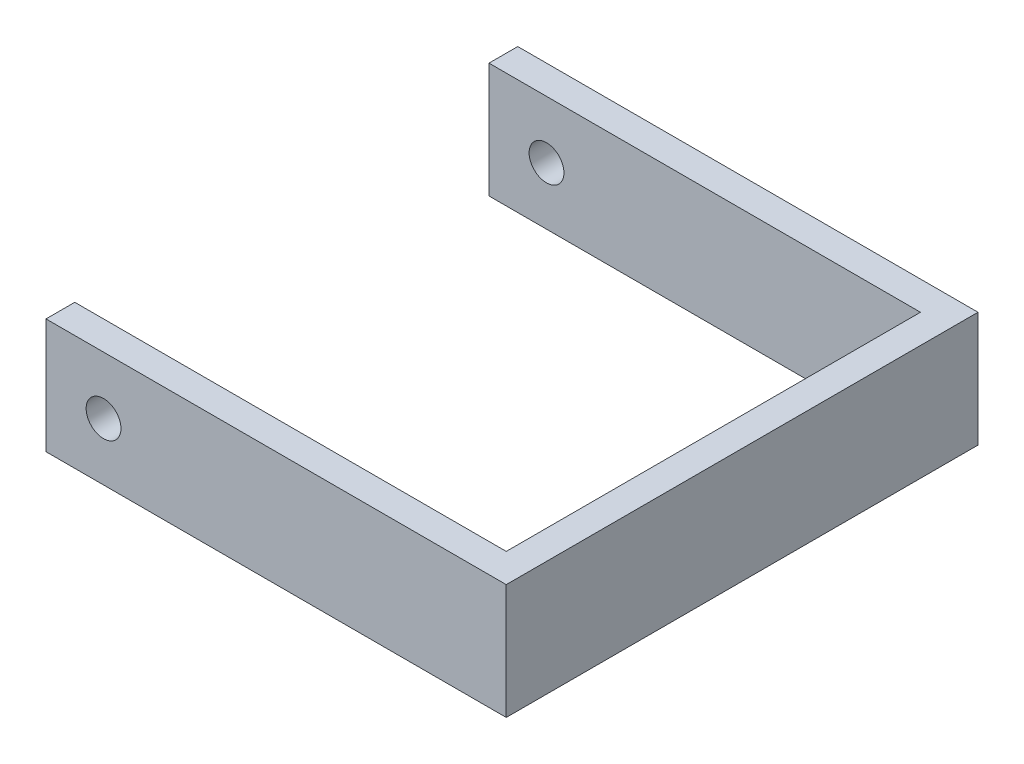
from build123d import *

# Parameters (mm, degrees)
BOSS_EXTRUDE1_DEPTH = 20
SKETCH3_R           = 3.025
CUT_EXTRUDE1_DEPTH  = 77


with BuildPart() as part:
    # Sketch2 → Boss-Extrude1 (new body)
    with BuildSketch(Plane(origin=(0, 0, 0), x_dir=(1, 0, 0), z_dir=(0, 1, 0))):
        Polygon((-53, 41), (27, 41), (27, -41), (-53, -41), (-53, -36), (22, -36), (22, 36), (-53, 36), align=None)
    extrude(amount=BOSS_EXTRUDE1_DEPTH)

    # Sketch3 → Cut-Extrude1 (cut)
    with BuildSketch(Plane.XY.offset(41)):
        with Locations((-43, 10)):
            Circle(SKETCH3_R)
    cut_extrude1 = extrude(amount=-CUT_EXTRUDE1_DEPTH, mode=Mode.SUBTRACT)

    # Mirror1: Cut-Extrude1 across plane
    add(cut_extrude1.mirror(Plane.XY), mode=Mode.SUBTRACT)


solid = part.part
